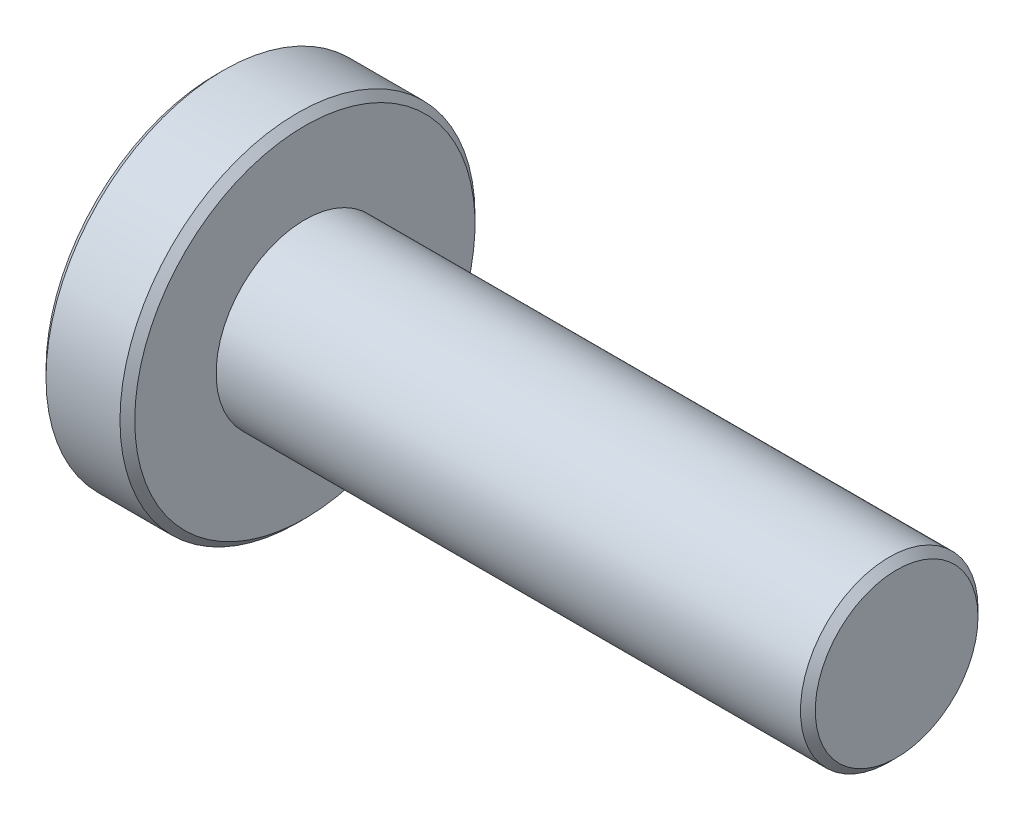
from build123d import *

# Parameters (mm, degrees)
SKETCH1_R           = 3
SHAFT_DEPTH         = 20
SKETCH2_R           = 6
BOSS_EXTRUDE2_DEPTH = 3
CHAMFER1_SIZE       = 0.25


with BuildPart() as part:
    # Sketch1 → SHAFT (new body)
    with BuildSketch(Plane(origin=(0, 0, 0), x_dir=(0, 0, -1), z_dir=(1, 0, 0))):
        Circle(SKETCH1_R)
    extrude(amount=SHAFT_DEPTH)

    # Sketch2 → Boss-Extrude2 (add)
    with BuildSketch(Plane.ZY):
        Circle(SKETCH2_R)
    extrude(amount=BOSS_EXTRUDE2_DEPTH)

    # Chamfer1
    chamfer1_edges = [part.edges().sort_by_distance(p)[0] for p in [
        (20, 0, 3),
        (0, 0, -6),
        (-3, 0, -6),
    ]]
    chamfer(chamfer1_edges, length=CHAMFER1_SIZE)


solid = part.part
